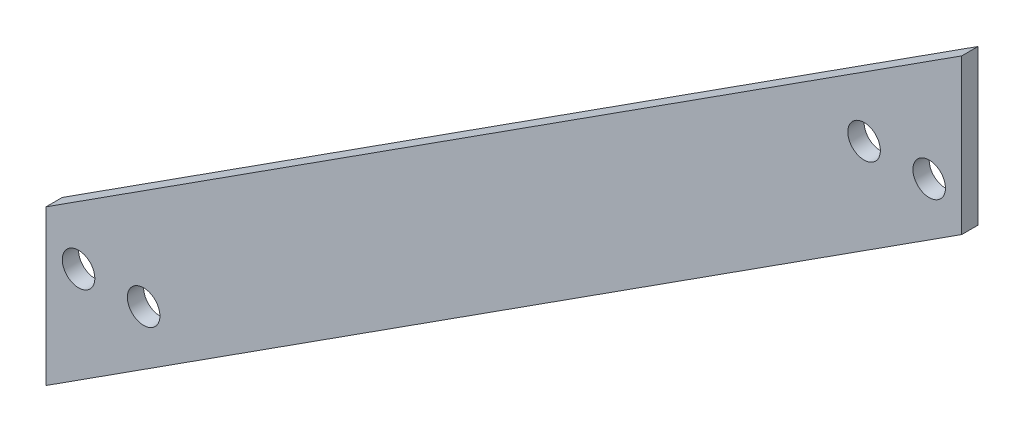
from build123d import *

# Parameters (mm, degrees)
SKETCH1_R           = 4.7625
BOSS_EXTRUDE1_DEPTH = 4.7625


with BuildPart() as part:
    # Sketch1 → Boss-Extrude1 (new body)
    with BuildSketch(Plane.XY):
        Polygon((0, 0), (0, -45.291363594), (267.97, 126.945997079), (267.97, 172.237360672), align=None)
        with Locations(Location((9.525, -11.001363594, 0), (0, 0, 180))):
            Circle(SKETCH1_R, mode=Mode.SUBTRACT)
        with Locations(Location((28.575, -11.001363594, 0), (0, 0, 180))):
            Circle(SKETCH1_R, mode=Mode.SUBTRACT)
        with Locations(Location((239.395, 136.318636406, 0), (0, 0, 180))):
            Circle(SKETCH1_R, mode=Mode.SUBTRACT)
        with Locations(Location((258.445, 136.318636406, 0), (0, 0, 180))):
            Circle(SKETCH1_R, mode=Mode.SUBTRACT)
    extrude(amount=BOSS_EXTRUDE1_DEPTH)


solid = part.part
